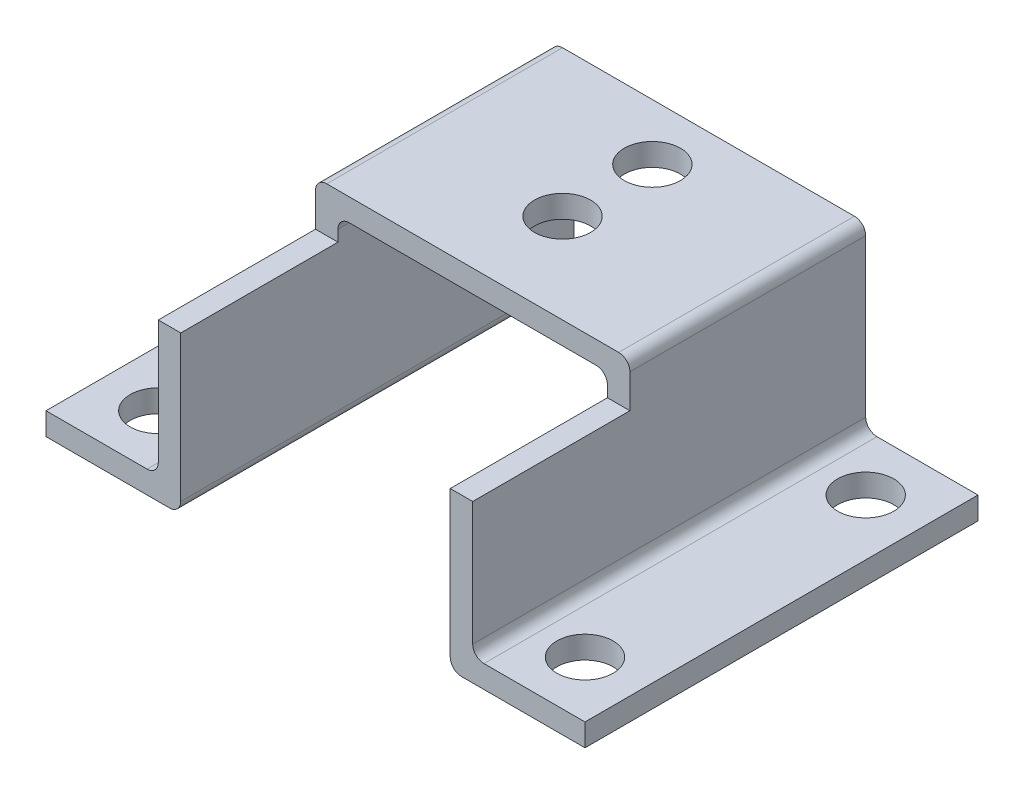
from build123d import *

# Parameters (mm, degrees)
BOSS_EXTRUDE1_DEPTH     = 35
SKETCH2_W               = 14
SKETCH2_H               = 4
CUT_EXTRUDE1_DEPTH      = 55.083269132
CUT_EXTRUDE2_DEPTH      = 46.354161882
CUT_EXTRUDE2_DEPTH_BACK = 46.354161882
SKETCH3_R               = 2.5


with BuildPart() as part:
    # Sketch1 → Boss-Extrude1 (new body)
    with BuildSketch(Plane.XY):
        with BuildLine():
            Line((-24, 0), (-15, 0))
            ThreePointArc((-15, 0), (-14.292893219, 0.292893219), (-14, 1))
            Line((-14, 1), (-14, 15))
            ThreePointArc((-14, 15), (-13.707106781, 15.707106781), (-13, 16))
            Line((-13, 16), (13, 16))
            ThreePointArc((13, 16), (13.707106781, 15.707106781), (14, 15))
            Line((14, 15), (14, 1))
            ThreePointArc((14, 1), (14.292893219, 0.292893219), (15, 0))
            Line((15, 0), (24, 0))
            Line((24, 0), (24, -2))
            Line((24, -2), (13, -2))
            ThreePointArc((13, -2), (12.292893219, -1.707106781), (12, -1))
            Line((12, -1), (12, 13))
            ThreePointArc((12, 13), (11.707106781, 13.707106781), (11, 14))
            Line((11, 14), (-11, 14))
            ThreePointArc((-11, 14), (-11.707106781, 13.707106781), (-12, 13))
            Line((-12, 13), (-12, -1))
            ThreePointArc((-12, -1), (-12.292893219, -1.707106781), (-13, -2))
            Line((-13, -2), (-24, -2))
            Line((-24, -2), (-24, 0))
        make_face()
    extrude(amount=BOSS_EXTRUDE1_DEPTH)

    # Sketch2 → Cut-Extrude1 (cut, through all)
    with BuildSketch(Plane(origin=(14, 0, 0), x_dir=(0, 0, -1), z_dir=(1, 0, 0))):
        with Locations((-28, 14)):
            Rectangle(SKETCH2_W, SKETCH2_H)
    extrude(amount=-CUT_EXTRUDE1_DEPTH, mode=Mode.SUBTRACT)

    # Sketch3 → Cut-Extrude2 (cut, two sides: drawn at the far end of the back side and taken through both)
    with BuildSketch(Plane(origin=(0, 0, 0), x_dir=(1, 0, 0), z_dir=(0, 1, 0)).offset(-CUT_EXTRUDE2_DEPTH_BACK)):
        with Locations(Location((-19, -5, 0), (0, 0, 180))):
            Circle(SKETCH3_R)
        with Locations(Location((-19, -30, 0), (0, 0, 180))):
            Circle(SKETCH3_R)
        with Locations((19, -30)):
            Circle(SKETCH3_R)
        with Locations((19, -5)):
            Circle(SKETCH3_R)
        with Locations(Location((0, -13, 0), (0, 0, 180))):
            Circle(SKETCH3_R)
        with Locations(Location((0, -5, 0), (0, 0, 180))):
            Circle(SKETCH3_R)
    extrude(amount=CUT_EXTRUDE2_DEPTH + CUT_EXTRUDE2_DEPTH_BACK, mode=Mode.SUBTRACT)


solid = part.part
